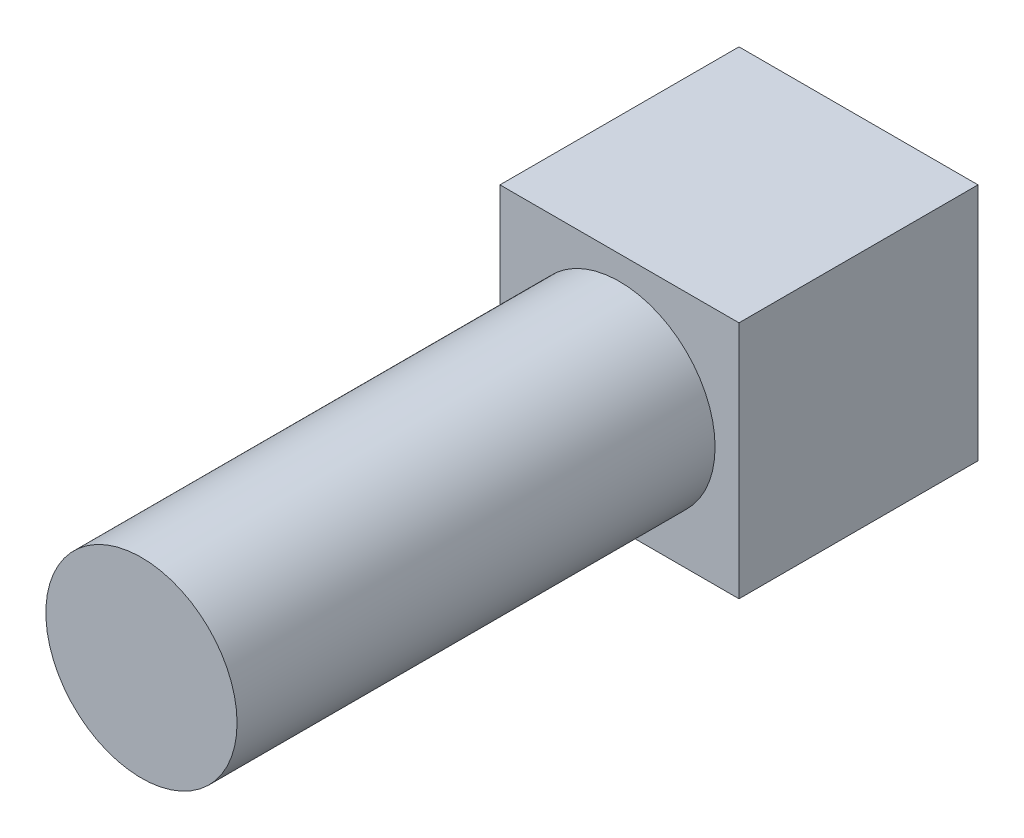
from build123d import *

# Parameters (mm, degrees)
SKETCH1_W           = 10
SKETCH1_H           = 10
BOSS_EXTRUDE1_DEPTH = 10
SKETCH2_R           = 4
BOSS_EXTRUDE2_DEPTH = 20


with BuildPart() as part:
    # Sketch1 → Boss-Extrude1 (new body)
    with BuildSketch(Plane(origin=(0, 0, 0), x_dir=(1, 0, 0), z_dir=(0, 1, 0))):
        Rectangle(SKETCH1_W, SKETCH1_H)
    extrude(amount=BOSS_EXTRUDE1_DEPTH)

    # Sketch2 → Boss-Extrude2 (add)
    with BuildSketch(Plane.XY.offset(5)):
        with Locations((0, 5)):
            Circle(SKETCH2_R)
    extrude(amount=BOSS_EXTRUDE2_DEPTH)


solid = part.part
